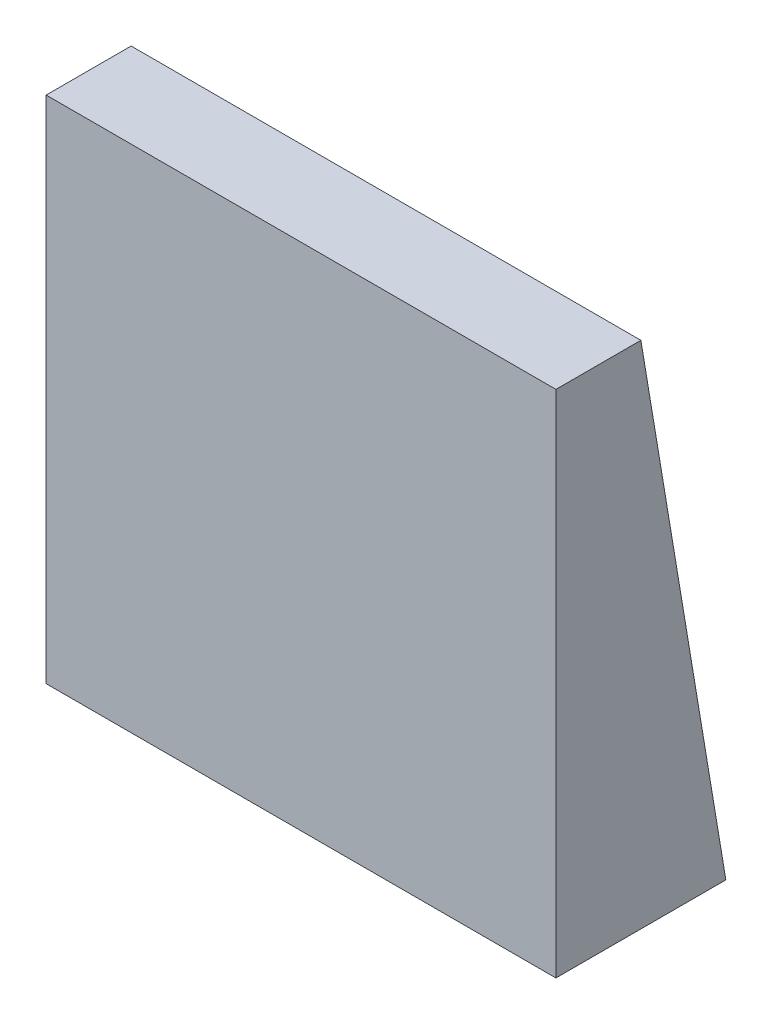
from build123d import *

# Parameters (mm, degrees)
SKETCH1_W                = 40
SKETCH1_H                = 40
BOSS_EXTRUDE1_DEPTH      = 20
SURFACE_EXTRUDE1_1_BACK  = 50
SURFACE_EXTRUDE1_1_DEPTH = 100


with BuildPart() as part:
    # Sketch1 → Boss-Extrude1 (new body)
    with BuildSketch(Plane.XY):
        with Locations((20, 20)):
            Rectangle(SKETCH1_W, SKETCH1_H)
    extrude(amount=BOSS_EXTRUDE1_DEPTH)

    # SurfaceCut1: cut with a surface, the side it looks to stays
    # Surface-Extrude1: a surface, the sketch's curves swept straight by 100 mm
    with BuildLine(Plane(origin=(0, 0, 0), x_dir=(0, 0, -1), z_dir=(1, 0, 0)).offset(-SURFACE_EXTRUDE1_1_BACK), mode=Mode.PRIVATE) as surface_extrude1_1_path:
        Line((-5, -10), (-15, 50))
    surface_extrude1_1 = Shell.extrude(surface_extrude1_1_path.wire(), (1 * SURFACE_EXTRUDE1_1_DEPTH, 0 * SURFACE_EXTRUDE1_1_DEPTH, 0 * SURFACE_EXTRUDE1_1_DEPTH))
    split(bisect_by=surface_extrude1_1, keep=Keep.TOP)


solid = part.part
